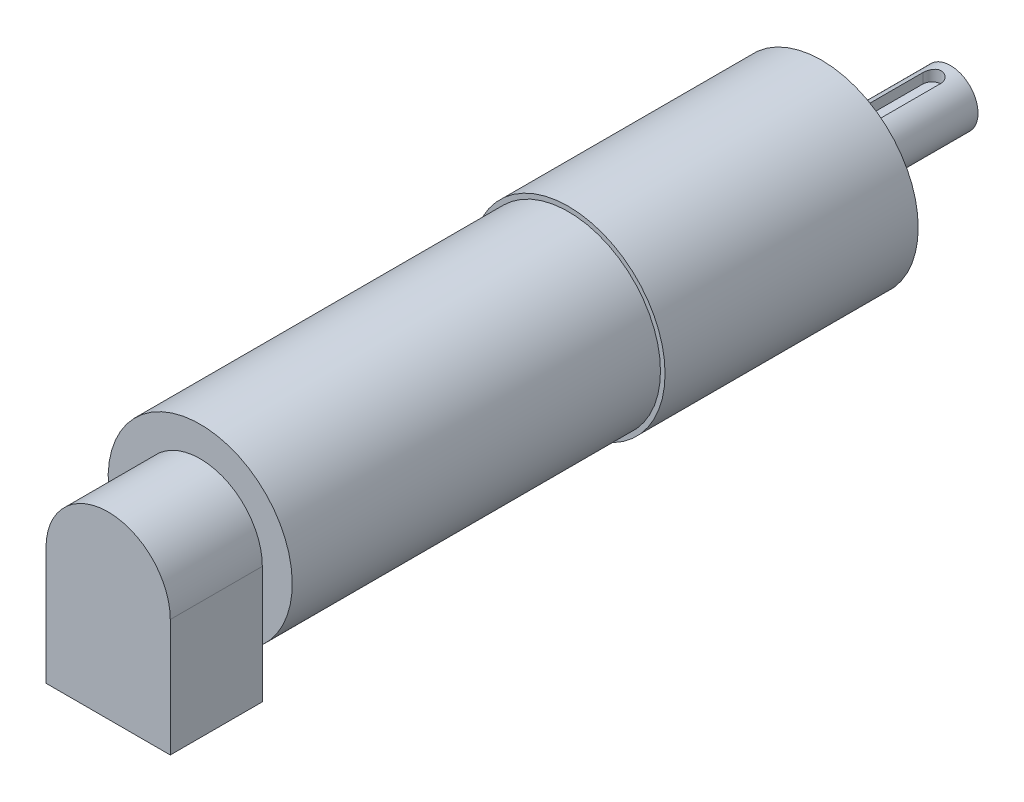
from build123d import *

# Parameters (mm, degrees)
SKETCH_1_R                  = 21
EXTRUDE_356_DEPTH           = 55
SKETCH_2_R                  = 20
EXTRUDE_456_DEPTH           = 80
EXTRUDE_680_DEPTH           = 20
SKETCH_5_R                  = 14
EXTRUDE_800_DEPTH           = 3
SKETCH_4_R                  = 6
EXTRUDE_922_DEPTH           = 25
CUT_EXTRUDE_1_DEPTH         = 2.5
HOLE_WIZARD_M4_1_AT_2_COUNT = 2
HOLE_WIZARD_M4_1_AT_2_PITCH = 24.748737342
HOLE_WIZARD_M4_1_AT_3_COUNT = 2
HOLE_WIZARD_M4_1_AT_3_PITCH = 35
HOLE_WIZARD_M4_1_AT_4_COUNT = 2
HOLE_WIZARD_M4_1_AT_4_PITCH = 24.748737342


with BuildPart() as part:
    # 草图1 → Extrude 356 (new body)
    with BuildSketch(Plane.XY):
        Circle(SKETCH_1_R)
    extrude(amount=EXTRUDE_356_DEPTH)

    # 草图2 → Extrude 456 (add)
    with BuildSketch(Plane.XY.offset(55)):
        Circle(SKETCH_2_R)
    extrude(amount=EXTRUDE_456_DEPTH)

    # 草图3 → Extrude 680 (add)
    with BuildSketch(Plane.XY.offset(135)):
        with BuildLine():
            Line((-13.5, -25.5), (13.5, -25.5))
            Line((13.5, -25.5), (13.5, 0))
            ThreePointArc((13.5, 0), (0, 13.5), (-13.5, 0))
            Line((-13.5, 0), (-13.5, -25.5))
        make_face()
    extrude(amount=EXTRUDE_680_DEPTH)

    # 草图5 → Extrude 800 (add)
    with BuildSketch(Plane(origin=(0, 0, 0), x_dir=(-1, 0, 0), z_dir=(0, 0, -1))):
        with Locations(Location((0, 0, 0), (0, 0, 180))):
            Circle(SKETCH_5_R)
    extrude(amount=EXTRUDE_800_DEPTH)

    # 草图7 → M4 螺纹孔1 (revolve, cut)
    with BuildSketch(Plane(origin=(0, 17.5, 0), x_dir=(0, 1, 0), z_dir=(1, 0, 0))):
        Polygon((0, 0), (0, 6.991420021), (1.65, 6), (1.65, 0), align=None)
    hole_wizard_m4_1 = revolve(axis=Axis((0, 17.5, -6.35), (0, 0, 1)), mode=Mode.SUBTRACT)

    # M4 螺纹孔1 at 2: M4 螺纹孔1 ×2
    with Locations(*[Vector(-0.7071067811865575, -0.7071067811865376, 0) * (i * HOLE_WIZARD_M4_1_AT_2_PITCH) for i in range(1, HOLE_WIZARD_M4_1_AT_2_COUNT)]):
        add(hole_wizard_m4_1, mode=Mode.SUBTRACT)

    # M4 螺纹孔1 at 3: M4 螺纹孔1 ×2
    with Locations(*[(0, -i * HOLE_WIZARD_M4_1_AT_3_PITCH, 0) for i in range(1, HOLE_WIZARD_M4_1_AT_3_COUNT)]):
        add(hole_wizard_m4_1, mode=Mode.SUBTRACT)

    # M4 螺纹孔1 at 4: M4 螺纹孔1 ×2
    with Locations(*[Vector(0.7071067811865376, -0.7071067811865576, 0) * (i * HOLE_WIZARD_M4_1_AT_4_PITCH) for i in range(1, HOLE_WIZARD_M4_1_AT_4_COUNT)]):
        add(hole_wizard_m4_1, mode=Mode.SUBTRACT)


with BuildPart() as body_2:
    # 草图4 → Extrude 922 (new body)
    with BuildSketch(Plane(origin=(0, 0, -3), x_dir=(-1, 0, 0), z_dir=(0, 0, -1))):
        Circle(SKETCH_4_R)
    extrude(amount=EXTRUDE_922_DEPTH)

    # 草图6 → 切除-拉伸1 (cut)
    with BuildSketch(Plane(origin=(0, 6, 0), x_dir=(-1, 0, 0), z_dir=(0, 1, 0))):
        with BuildLine():
            Line((-2, -24), (-2, -8))
            ThreePointArc((-2, -8), (0, -6), (2, -8))
            Line((2, -8), (2, -24))
            ThreePointArc((2, -24), (0, -26), (-2, -24))
        make_face()
    extrude(amount=-CUT_EXTRUDE_1_DEPTH, mode=Mode.SUBTRACT)


solid = Compound([part.part, body_2.part])
